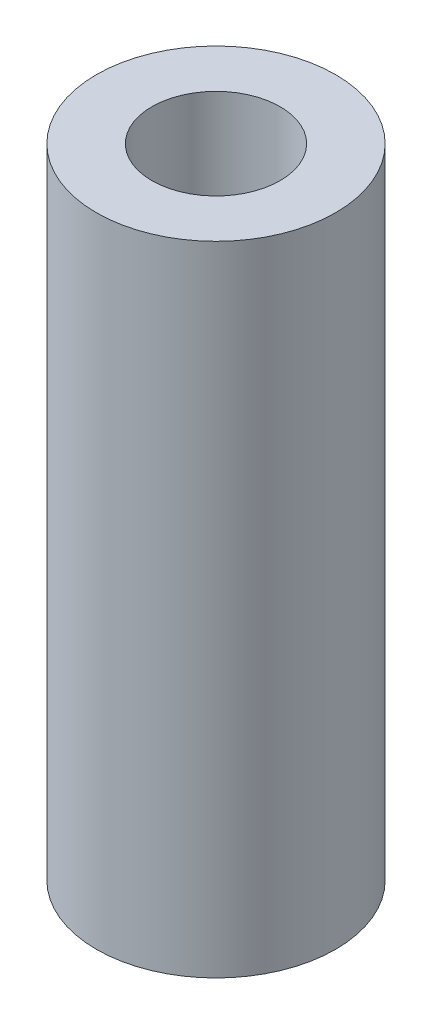
from build123d import *

# Parameters (mm, degrees)
SKETCH1_R           = 4.7625
SKETCH1_R_2         = 2.5527
BOSS_EXTRUDE1_DEPTH = 25.4


with BuildPart() as part:
    # Sketch1 → Boss-Extrude1 (new body)
    with BuildSketch(Plane(origin=(0, 0, 0), x_dir=(1, 0, 0), z_dir=(0, 1, 0))):
        with Locations(Location((0, 0, 0), (0, 0, 270))):
            Circle(SKETCH1_R)
        with Locations(Location((0, 0, 0), (0, 0, 270))):
            Circle(SKETCH1_R_2, mode=Mode.SUBTRACT)
    extrude(amount=BOSS_EXTRUDE1_DEPTH)


solid = part.part
